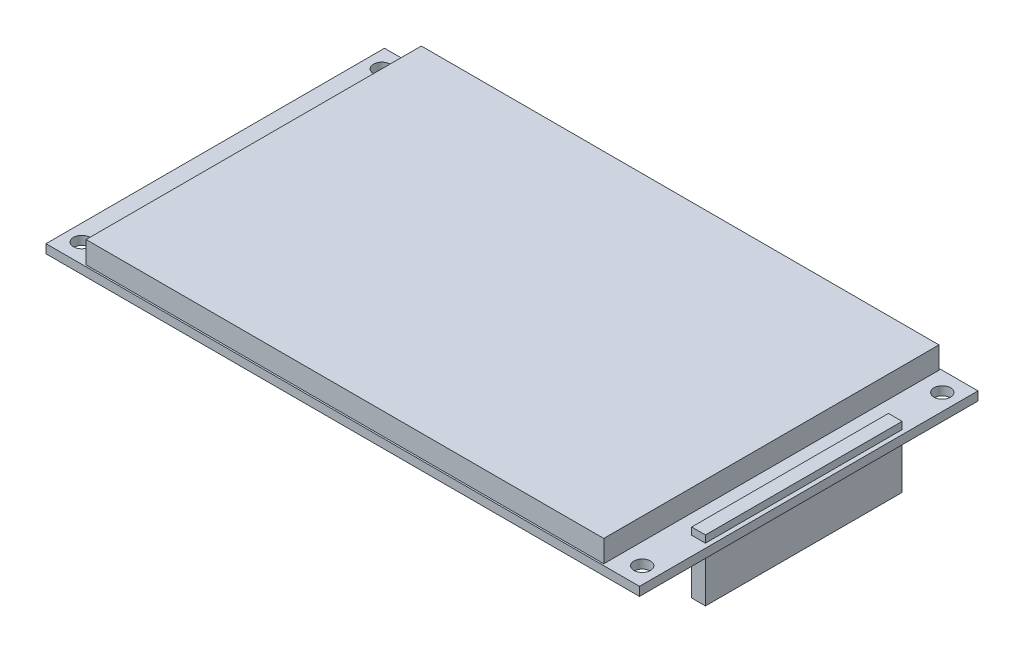
from build123d import *

# Parameters (mm, degrees)
SCHIZZO1_W                        = 94.2
SCHIZZO1_H                        = 61
ESTRUSIONE_ESTRUSIONE1_DEPTH      = 4
SCHIZZO2_W                        = 108
SCHIZZO2_H                        = 61.6
ESTRUSIONE_ESTRUSIONE2_DEPTH      = 1.6
ESTRUSIONE_ESTRUSIONE3_DEPTH      = 1.3
ESTRUSIONE_ESTRUSIONE3_DEPTH_BACK = 9.9
SCHIZZO4_W                        = 2.5
SCHIZZO4_H                        = 35.8
SCHIZZO6_R                        = 1.5
TAGLIO_ESTRUSIONE1_DEPTH          = 2
SCHIZZO7_W                        = 27
SCHIZZO7_H                        = 17
ESTRUSIONE_ESTRUSIONE4_DEPTH      = 3


with BuildPart() as part:
    # Schizzo1 → Estrusione-Estrusione1 (new body)
    with BuildSketch(Plane(origin=(0, 0, 0), x_dir=(1, 0, 0), z_dir=(0, 1, 0))):
        with Locations((47.1, 30.5)):
            Rectangle(SCHIZZO1_W, SCHIZZO1_H)
    extrude(amount=ESTRUSIONE_ESTRUSIONE1_DEPTH)

    # Schizzo2 → Estrusione-Estrusione2 (add)
    with BuildSketch(Plane.XZ):
        with Locations((47, -30.5)):
            Rectangle(SCHIZZO2_W, SCHIZZO2_H)
    extrude(amount=ESTRUSIONE_ESTRUSIONE2_DEPTH)

    # Schizzo4 → Estrusione-Estrusione3 (add, two sides: drawn at the far end of the back side and taken through both)
    with BuildSketch(Plane(origin=(0, 0, 0), x_dir=(1, 0, 0), z_dir=(0, 1, 0)).offset(-ESTRUSIONE_ESTRUSIONE3_DEPTH_BACK)):
        with Locations((98.95, 30.4)):
            Rectangle(SCHIZZO4_W, SCHIZZO4_H)
    extrude(amount=ESTRUSIONE_ESTRUSIONE3_DEPTH + ESTRUSIONE_ESTRUSIONE3_DEPTH_BACK)

    # Schizzo6 → Taglio-Estrusione1 (cut)
    with BuildSketch(Plane(origin=(0, 0, 0), x_dir=(1, 0, 0), z_dir=(0, 1, 0))):
        with Locations(Location((-4, 57.8, 0), (0, 0, 270))):
            Circle(SCHIZZO6_R)
        with Locations(Location((-4, 3.2, 0), (0, 0, 270))):
            Circle(SCHIZZO6_R)
        with Locations(Location((98, 57.8, 0), (0, 0, 270))):
            Circle(SCHIZZO6_R)
        with Locations(Location((98, 3.2, 0), (0, 0, 270))):
            Circle(SCHIZZO6_R)
    extrude(amount=-TAGLIO_ESTRUSIONE1_DEPTH, mode=Mode.SUBTRACT)

    # Schizzo7 → Estrusione-Estrusione4 (add)
    with BuildSketch(Plane.XZ.offset(1.6)):
        with Locations((34.5, -12.7)):
            Rectangle(SCHIZZO7_W, SCHIZZO7_H)
    extrude(amount=ESTRUSIONE_ESTRUSIONE4_DEPTH)


solid = part.part
